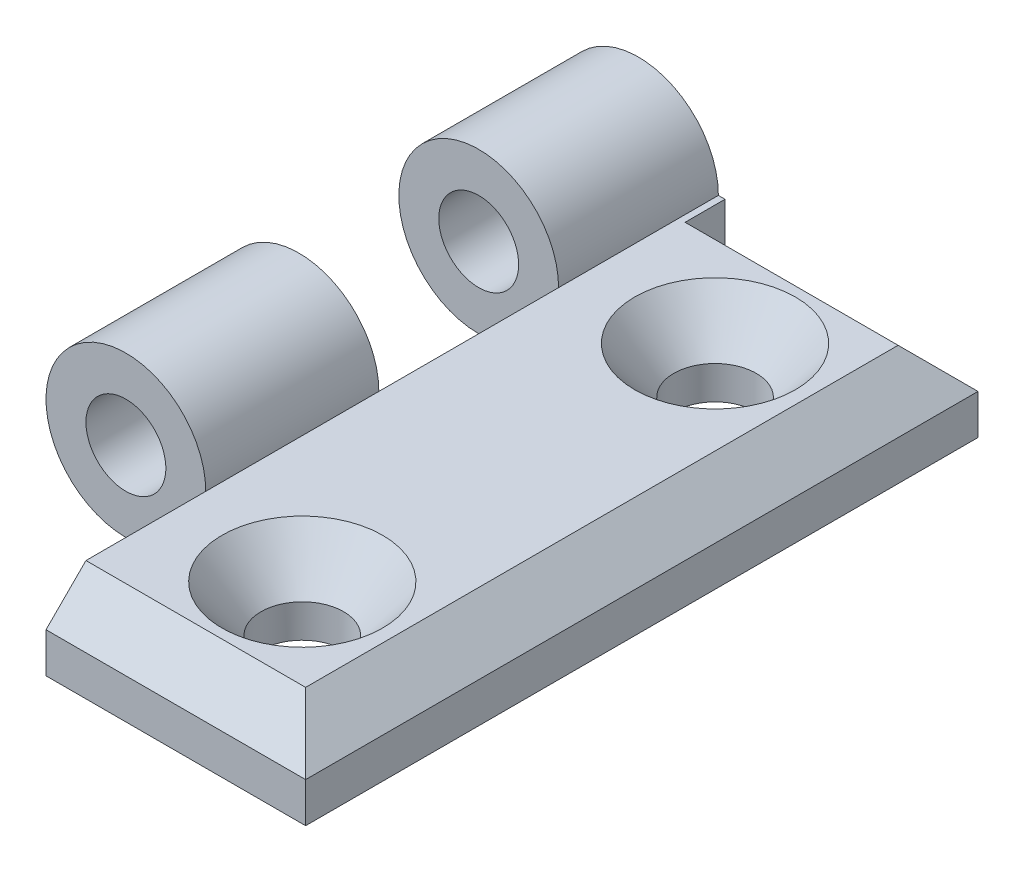
from build123d import *

# Parameters (mm, degrees)
SKETCH_1_R                    = 3
EXTRUDE_1_DEPTH               = 50.5
CUT_EXTRUDE_2_DEPTH           = 50.5
CUT_EXTRUDE_2_DEPTH_BACK      = 58.831652233
SKETCH_3_R                    = 3.1
SKETCH_3_W                    = 28.166385617
SKETCH_3_H                    = 19.728727066
SKETCH_3_W_2                  = 28.6736781
SKETCH_3_H_2                  = 13.5
CUT_EXTRUDE_START             = 6.5
CUT_EXTRUDE_3_DEPTH           = 50.5
CHAMFER_1_SIZE                = 3
CUT_EXTRUDE_START_2           = 2.5
SKETCH_3_2_R                  = 3.1
CUT_EXTRUDE_5_DEPTH           = 10
CUT_EXTRUDE_5_DRAFT           = -40
CUT_EXTRUDE_5_PROFILE_2_DEPTH = 10
CUT_EXTRUDE_5_PROFILE_2_DRAFT = -40


with BuildPart() as part:
    # Эскиз1 → Бобышка-Вытянуть1 (new body)
    with BuildSketch(Plane.XY):
        with BuildLine():
            Line((0, 0), (25.5, 0))
            Line((25.5, 0), (25.5, 6))
            Line((25.5, 6), (6, 6))
            ThreePointArc((6, 6), (-4.242640687, 10.242640687), (0, 0))
        make_face()
        with Locations((0, 6)):
            Circle(SKETCH_1_R, mode=Mode.SUBTRACT)
    extrude(amount=EXTRUDE_1_DEPTH)

    # Эскиз3 → Вырез-Вытянуть2 (cut, two sides: drawn at the far end of the back side and taken through both)
    with BuildSketch(Plane(origin=(0, 0, 0), x_dir=(1, 0, 0), z_dir=(0, 1, 0)).offset(-CUT_EXTRUDE_2_DEPTH_BACK)):
        with Locations((15.5, -9.75)):
            Circle(SKETCH_3_R)
        with Locations((15.5, -40.75)):
            Circle(SKETCH_3_R)
        with Locations((-8.083192809, -48.364363533)):
            Rectangle(SKETCH_3_W, SKETCH_3_H)
        with Locations((-8.33683905, -18.75)):
            Rectangle(SKETCH_3_W_2, SKETCH_3_H_2)
    extrude(amount=CUT_EXTRUDE_2_DEPTH + CUT_EXTRUDE_2_DEPTH_BACK, mode=Mode.SUBTRACT)

    # Эскиз4 → Вырез-Вытянуть3 (cut)
    with BuildSketch(Plane(origin=(0, 0, 0), x_dir=(0, 0, -1), z_dir=(1, 0, 0)).offset(CUT_EXTRUDE_START)):
        Polygon((0, 6), (-3, 6), (0, 3), align=None)
    extrude(amount=CUT_EXTRUDE_3_DEPTH, mode=Mode.SUBTRACT)

    # Фаска1
    chamfer_1_edges = [part.edges().sort_by_distance(p)[0] for p in [
        (15.75, 6, 50.5),
        (25.5, 6, 26.75),
    ]]
    chamfer(chamfer_1_edges, length=CHAMFER_1_SIZE)


with BuildPart() as cut_extrude_5_tool:
    # Эскиз3<2> → Вырез-Вытянуть5 (with draft: the straight prism first)
    with BuildSketch(Plane(origin=(0, 0, 0), x_dir=(1, 0, 0), z_dir=(0, 1, 0)).offset(CUT_EXTRUDE_START_2)):
        with Locations((15.5, -9.75)):
            Circle(SKETCH_3_2_R)
    extrude(amount=CUT_EXTRUDE_5_DEPTH)
    # Вырез-Вытянуть5: the draft: its side faces are tilted about the plane it starts from
    cut_extrude_5_sides = [cut_extrude_5_tool.faces().sort_by_distance(p)[0] for p in [
        (12.4, 7.5, 9.75),
    ]]
    draft(cut_extrude_5_sides, Plane(origin=(0, 0, 0), x_dir=(1, 0, 0), z_dir=(0, 1, 0)).offset(CUT_EXTRUDE_START_2), CUT_EXTRUDE_5_DRAFT)


with BuildPart() as part_1:
    add(part.part)

    # Вырез-Вытянуть5: cut by cut_extrude_5_tool
    add(cut_extrude_5_tool.part, mode=Mode.SUBTRACT)


with BuildPart() as cut_extrude_5_profile_2_tool:
    # Эскиз3<2> → Вырез-Вытянуть5 profile 2 (with draft: the straight prism first)
    with BuildSketch(Plane(origin=(0, 0, 0), x_dir=(1, 0, 0), z_dir=(0, 1, 0)).offset(CUT_EXTRUDE_START_2)):
        with Locations((15.5, -40.75)):
            Circle(SKETCH_3_2_R)
    extrude(amount=CUT_EXTRUDE_5_PROFILE_2_DEPTH)
    # Вырез-Вытянуть5 profile 2: the draft: its side faces are tilted about the plane it starts from
    cut_extrude_5_profile_2_sides = [cut_extrude_5_profile_2_tool.faces().sort_by_distance(p)[0] for p in [
        (12.4, 7.5, 40.75),
    ]]
    draft(cut_extrude_5_profile_2_sides, Plane(origin=(0, 0, 0), x_dir=(1, 0, 0), z_dir=(0, 1, 0)).offset(CUT_EXTRUDE_START_2), CUT_EXTRUDE_5_PROFILE_2_DRAFT)


with BuildPart() as part_2:
    add(part_1.part)

    # Вырез-Вытянуть5 profile 2: cut by cut_extrude_5_profile_2_tool
    add(cut_extrude_5_profile_2_tool.part, mode=Mode.SUBTRACT)


solid = part_2.part
